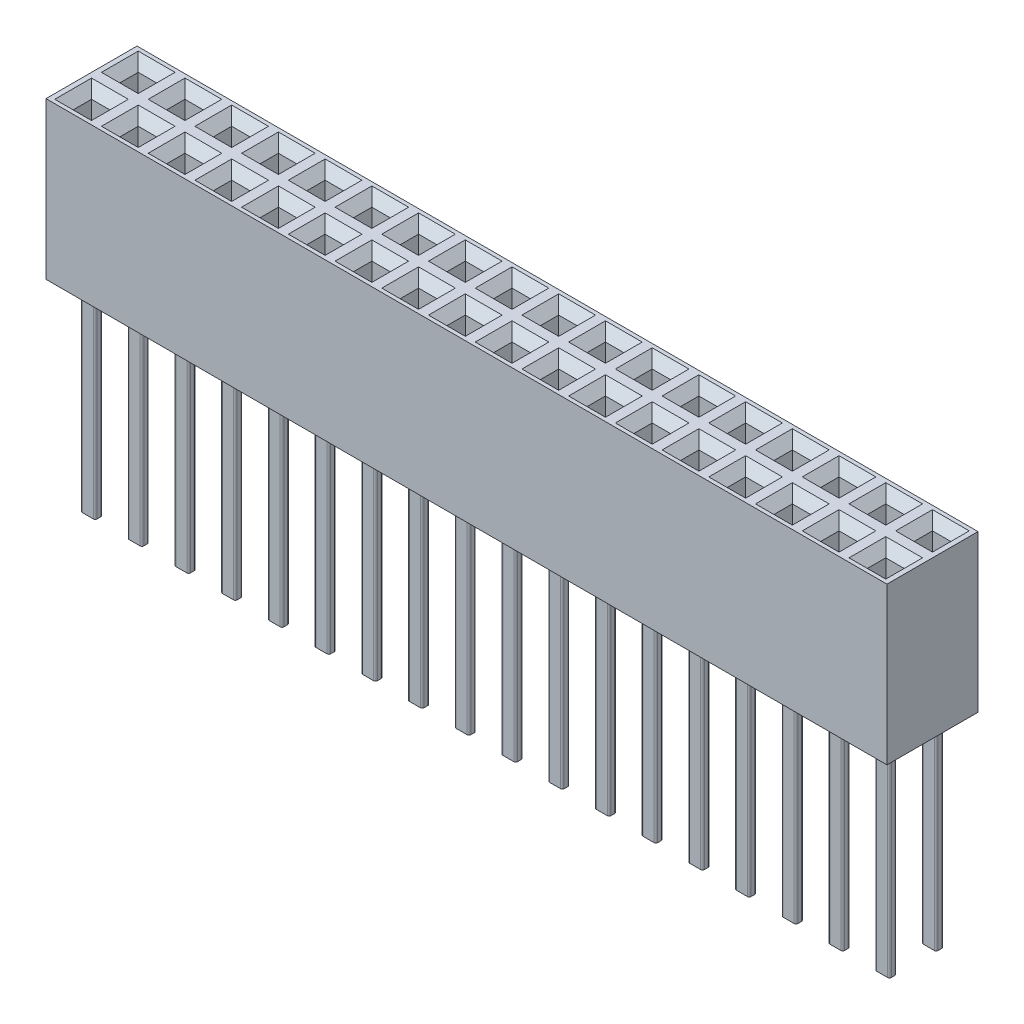
from build123d import *

# Parameters (mm, degrees)
SKETCH2_W                  = 45.72
SKETCH2_H                  = 4.95
BOSS_EXTRUDE1_DEPTH        = 8.51
SKETCH5_W                  = 1
SKETCH5_H                  = 1
CUT_EXTRUDE1_DEPTH         = 5
CHAMFER1_SIZE              = 0.5
LPATTERN3_COUNT            = 18
LPATTERN3_PITCH            = 2.54
CHAMFER1_OF_LPATTERN3_SIZE = 0.5
BOSS_EXTRUDE2_DEPTH        = 11
LPATTERN1_COUNT            = 18
LPATTERN1_PITCH            = 2.54
LPATTERN1_COUNT_DIR2       = 2
LPATTERN1_PITCH_DIR2       = 2.54


with BuildPart() as part:
    # Sketch2 → Boss-Extrude1 (new body)
    with BuildSketch(Plane(origin=(0, 0, 0), x_dir=(1, 0, 0), z_dir=(0, 1, 0))):
        with Locations((21.59, 0)):
            Rectangle(SKETCH2_W, SKETCH2_H)
    extrude(amount=BOSS_EXTRUDE1_DEPTH)

    # Sketch5 → Cut-Extrude1 (cut)
    with BuildSketch(Plane(origin=(0, 8.51, 0), x_dir=(1, 0, 0), z_dir=(0, 1, 0))):
        with Locations((0, 1.27)):
            Rectangle(SKETCH5_W, SKETCH5_H)
        with Locations((0, -1.27)):
            Rectangle(SKETCH5_W, SKETCH5_H)
    cut_extrude1 = extrude(amount=-CUT_EXTRUDE1_DEPTH, mode=Mode.SUBTRACT)

    # Chamfer1
    chamfer1_edges = [part.edges().sort_by_distance(p)[0] for p in [
        (0.5, 8.51, -1.27),
        (0, 8.51, -1.77),
        (-0.5, 8.51, -1.27),
        (0, 8.51, -0.77),
        (-0.5, 8.51, 1.27),
        (0, 8.51, 1.77),
        (0.5, 8.51, 1.27),
        (0, 8.51, 0.77),
    ]]
    chamfer(chamfer1_edges, length=CHAMFER1_SIZE)

    # LPattern3: Cut-Extrude1 ×18
    with Locations(*[(i * LPATTERN3_PITCH, 0, 0) for i in range(1, LPATTERN3_COUNT)]):
        add(cut_extrude1, mode=Mode.SUBTRACT)

    # Chamfer1 of LPattern3
    chamfer1_of_lpattern3_edges = [part.edges().sort_by_distance(p)[0] for p in [
        (3.04, 8.51, -1.27),
        (2.54, 8.51, -1.77),
        (2.04, 8.51, -1.27),
        (2.54, 8.51, -0.77),
        (2.04, 8.51, 1.27),
        (2.54, 8.51, 1.77),
        (3.04, 8.51, 1.27),
        (2.54, 8.51, 0.77),
        (5.58, 8.51, -1.27),
        (5.08, 8.51, -1.77),
        (4.58, 8.51, -1.27),
        (5.08, 8.51, -0.77),
        (4.58, 8.51, 1.27),
        (5.08, 8.51, 1.77),
        (5.58, 8.51, 1.27),
        (5.08, 8.51, 0.77),
        (8.12, 8.51, -1.27),
        (7.62, 8.51, -1.77),
        (7.12, 8.51, -1.27),
        (7.62, 8.51, -0.77),
        (7.12, 8.51, 1.27),
        (7.62, 8.51, 1.77),
        (8.12, 8.51, 1.27),
        (7.62, 8.51, 0.77),
        (10.66, 8.51, -1.27),
        (10.16, 8.51, -1.77),
        (9.66, 8.51, -1.27),
        (10.16, 8.51, -0.77),
        (9.66, 8.51, 1.27),
        (10.16, 8.51, 1.77),
        (10.66, 8.51, 1.27),
        (10.16, 8.51, 0.77),
        (13.2, 8.51, -1.27),
        (12.7, 8.51, -1.77),
        (12.2, 8.51, -1.27),
        (12.7, 8.51, -0.77),
        (12.2, 8.51, 1.27),
        (12.7, 8.51, 1.77),
        (13.2, 8.51, 1.27),
        (12.7, 8.51, 0.77),
        (15.74, 8.51, -1.27),
        (15.24, 8.51, -1.77),
        (14.74, 8.51, -1.27),
        (15.24, 8.51, -0.77),
        (14.74, 8.51, 1.27),
        (15.24, 8.51, 1.77),
        (15.74, 8.51, 1.27),
        (15.24, 8.51, 0.77),
        (18.28, 8.51, -1.27),
        (17.78, 8.51, -1.77),
        (17.28, 8.51, -1.27),
        (17.78, 8.51, -0.77),
        (17.28, 8.51, 1.27),
        (17.78, 8.51, 1.77),
        (18.28, 8.51, 1.27),
        (17.78, 8.51, 0.77),
        (20.82, 8.51, -1.27),
        (20.32, 8.51, -1.77),
        (19.82, 8.51, -1.27),
        (20.32, 8.51, -0.77),
        (19.82, 8.51, 1.27),
        (20.32, 8.51, 1.77),
        (20.82, 8.51, 1.27),
        (20.32, 8.51, 0.77),
        (23.36, 8.51, -1.27),
        (22.86, 8.51, -1.77),
        (22.36, 8.51, -1.27),
        (22.86, 8.51, -0.77),
        (22.36, 8.51, 1.27),
        (22.86, 8.51, 1.77),
        (23.36, 8.51, 1.27),
        (22.86, 8.51, 0.77),
        (25.9, 8.51, -1.27),
        (25.4, 8.51, -1.77),
        (24.9, 8.51, -1.27),
        (25.4, 8.51, -0.77),
        (24.9, 8.51, 1.27),
        (25.4, 8.51, 1.77),
        (25.9, 8.51, 1.27),
        (25.4, 8.51, 0.77),
        (28.44, 8.51, -1.27),
        (27.94, 8.51, -1.77),
        (27.44, 8.51, -1.27),
        (27.94, 8.51, -0.77),
        (27.44, 8.51, 1.27),
        (27.94, 8.51, 1.77),
        (28.44, 8.51, 1.27),
        (27.94, 8.51, 0.77),
        (30.98, 8.51, -1.27),
        (30.48, 8.51, -1.77),
        (29.98, 8.51, -1.27),
        (30.48, 8.51, -0.77),
        (29.98, 8.51, 1.27),
        (30.48, 8.51, 1.77),
        (30.98, 8.51, 1.27),
        (30.48, 8.51, 0.77),
        (33.52, 8.51, -1.27),
        (33.02, 8.51, -1.77),
        (32.52, 8.51, -1.27),
        (33.02, 8.51, -0.77),
        (32.52, 8.51, 1.27),
        (33.02, 8.51, 1.77),
        (33.52, 8.51, 1.27),
        (33.02, 8.51, 0.77),
        (36.06, 8.51, -1.27),
        (35.56, 8.51, -1.77),
        (35.06, 8.51, -1.27),
        (35.56, 8.51, -0.77),
        (35.06, 8.51, 1.27),
        (35.56, 8.51, 1.77),
        (36.06, 8.51, 1.27),
        (35.56, 8.51, 0.77),
        (38.6, 8.51, -1.27),
        (38.1, 8.51, -1.77),
        (37.6, 8.51, -1.27),
        (38.1, 8.51, -0.77),
        (37.6, 8.51, 1.27),
        (38.1, 8.51, 1.77),
        (38.6, 8.51, 1.27),
        (38.1, 8.51, 0.77),
        (41.14, 8.51, -1.27),
        (40.64, 8.51, -1.77),
        (40.14, 8.51, -1.27),
        (40.64, 8.51, -0.77),
        (40.14, 8.51, 1.27),
        (40.64, 8.51, 1.77),
        (41.14, 8.51, 1.27),
        (40.64, 8.51, 0.77),
        (43.68, 8.51, -1.27),
        (43.18, 8.51, -1.77),
        (42.68, 8.51, -1.27),
        (43.18, 8.51, -0.77),
        (42.68, 8.51, 1.27),
        (43.18, 8.51, 1.77),
        (43.68, 8.51, 1.27),
        (43.18, 8.51, 0.77),
    ]]
    chamfer(chamfer1_of_lpattern3_edges, length=CHAMFER1_OF_LPATTERN3_SIZE)

    # Sketch8 → Boss-Extrude2 (add)
    with BuildSketch(Plane(origin=(0, 0, 0), x_dir=(1, 0, 0), z_dir=(0, 1, 0))):
        with BuildLine():
            Line((-0.3, -1.47), (0.3, -1.47))
            ThreePointArc((0.3, -1.47), (0.370710678, -1.440710678), (0.4, -1.37))
            Line((0.4, -1.37), (0.4, -1.17))
            ThreePointArc((0.4, -1.17), (0.370710678, -1.099289322), (0.3, -1.07))
            Line((0.3, -1.07), (-0.3, -1.07))
            ThreePointArc((-0.3, -1.07), (-0.370710678, -1.099289322), (-0.4, -1.17))
            Line((-0.4, -1.17), (-0.4, -1.37))
            ThreePointArc((-0.4, -1.37), (-0.370710678, -1.440710678), (-0.3, -1.47))
        make_face()
    boss_extrude2 = extrude(amount=-BOSS_EXTRUDE2_DEPTH)

    # LPattern1: Boss-Extrude2 18 × 2
    with Locations(*[(i * LPATTERN1_PITCH, 0, -j * LPATTERN1_PITCH_DIR2) for i in range(LPATTERN1_COUNT) for j in range(LPATTERN1_COUNT_DIR2) if (i, j) != (0, 0)]):
        add(boss_extrude2)


solid = part.part
